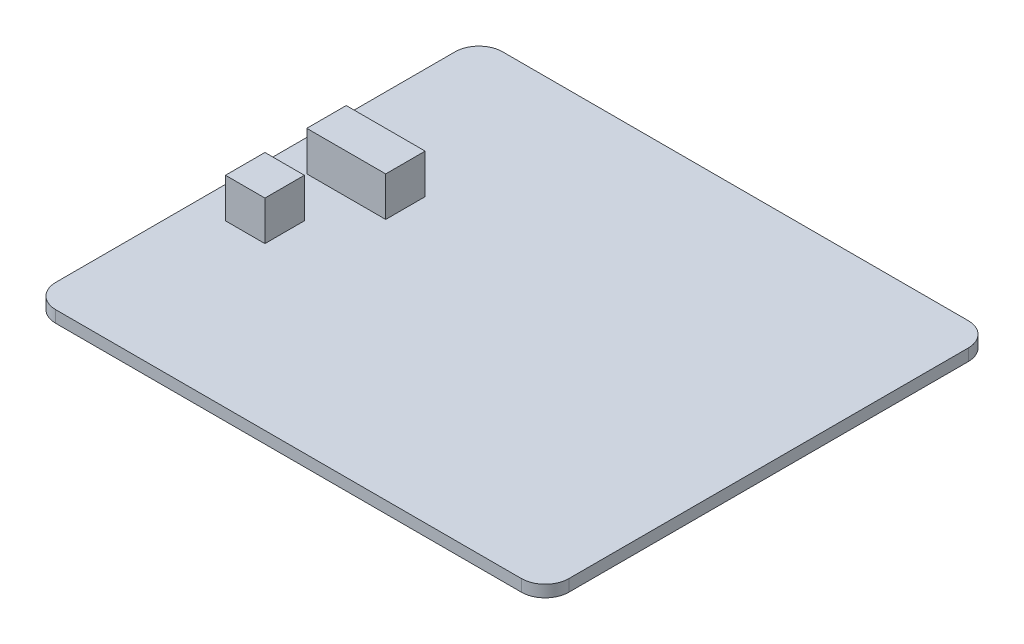
from build123d import *

# Parameters (mm, degrees)
SKETCH1_W           = 65
SKETCH1_H           = 56.6
BOSS_EXTRUDE1_DEPTH = 1.5
FILLET1_R           = 3
SKETCH2_W           = 5
SKETCH2_H           = 5
SKETCH2_W_2         = 10
BOSS_EXTRUDE2_DEPTH = 5


with BuildPart() as part:
    # Sketch1 → Boss-Extrude1 (new body)
    with BuildSketch(Plane(origin=(0, 0, 0), x_dir=(1, 0, 0), z_dir=(0, 1, 0))):
        with Locations((32.5, 28.3)):
            Rectangle(SKETCH1_W, SKETCH1_H)
    extrude(amount=BOSS_EXTRUDE1_DEPTH)

    # Fillet1
    fillet1_edges = [part.edges().sort_by_distance(p)[0] for p in [
        (0, 0.75, -56.6),
        (65, 0.75, -56.6),
        (65, 0.75, 0),
        (0, 0.75, 0),
    ]]
    fillet(fillet1_edges, radius=FILLET1_R)

    # Sketch2 → Boss-Extrude2 (add)
    with BuildSketch(Plane(origin=(0, 1.5, 0), x_dir=(1, 0, 0), z_dir=(0, 1, 0))):
        with Locations((6.5, 23)):
            Rectangle(SKETCH2_W, SKETCH2_H)
        with Locations((9, 33.3)):
            Rectangle(SKETCH2_W_2, SKETCH2_H)
    extrude(amount=BOSS_EXTRUDE2_DEPTH)


solid = part.part
